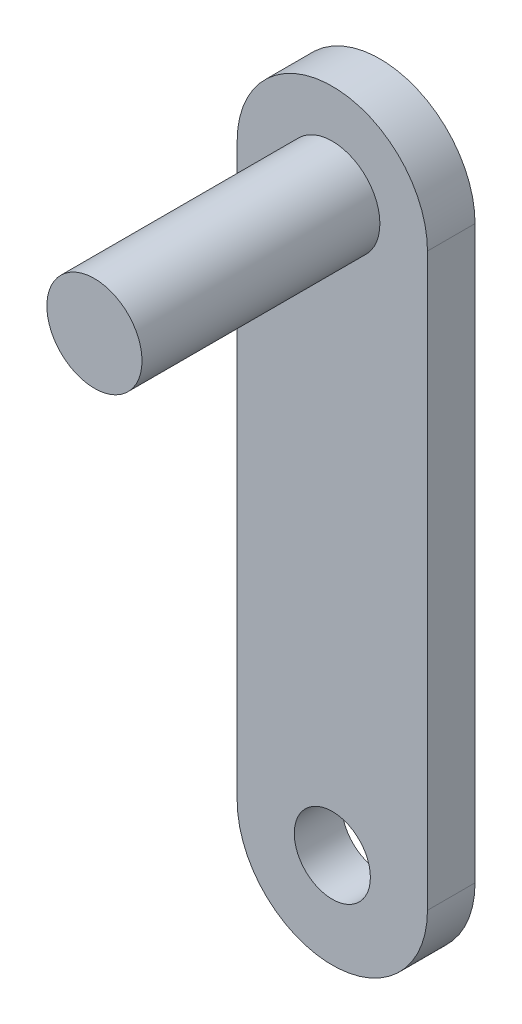
from build123d import *

# Parameters (mm, degrees)
SKETCH1_R           = 5
SKETCH1_R_2         = 4
BOSS_EXTRUDE1_DEPTH = 5
SKETCH1_2_R         = 5
BOSS_EXTRUDE2_DEPTH = 30


with BuildPart() as part:
    # Sketch1 → Boss-Extrude1 (new body)
    with BuildSketch(Plane.XY):
        with BuildLine():
            Line((10, 30), (10, -30))
            ThreePointArc((10, -30), (0, -40), (-10, -30))
            Line((-10, -30), (-10, 30))
            ThreePointArc((-10, 30), (0, 40), (10, 30))
        make_face()
        with Locations((0, 30)):
            Circle(SKETCH1_R, mode=Mode.SUBTRACT)
        with Locations((0, -30)):
            Circle(SKETCH1_R_2, mode=Mode.SUBTRACT)
    extrude(amount=BOSS_EXTRUDE1_DEPTH)

    # Sketch1<2> → Boss-Extrude2 (add)
    with BuildSketch(Plane.XY):
        with Locations((0, 30)):
            Circle(SKETCH1_2_R)
    extrude(amount=BOSS_EXTRUDE2_DEPTH)


solid = part.part
